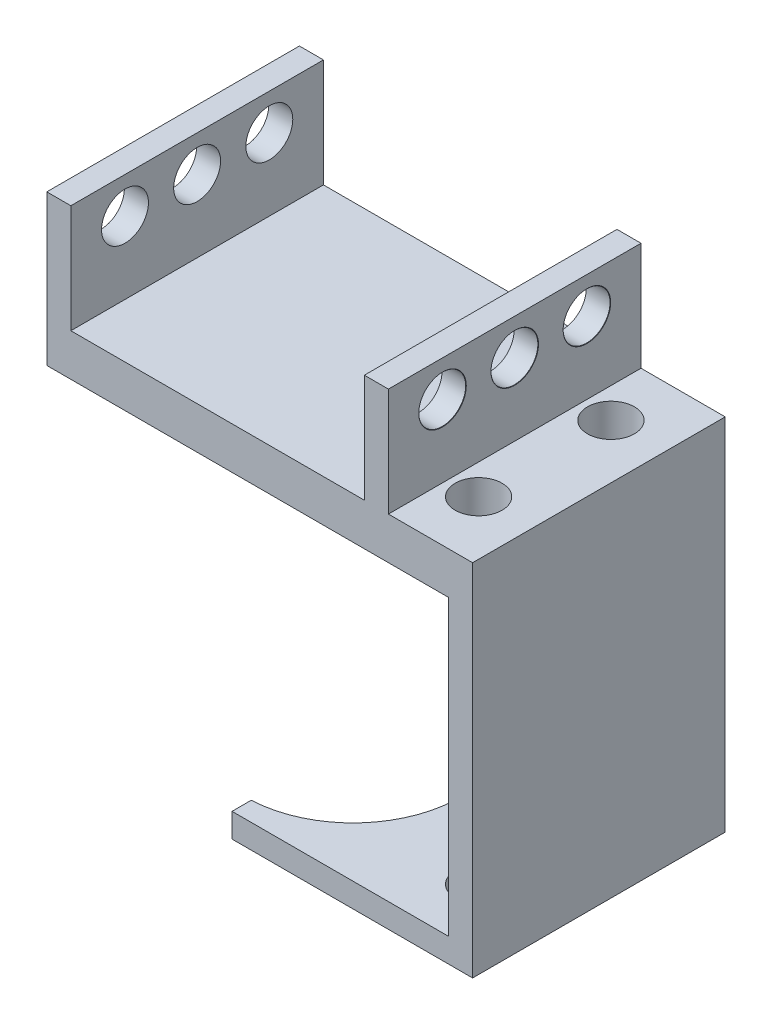
from build123d import *

# Parameters (mm, degrees)
BOSS_EXTRUDE1_DEPTH              = 21
M3_5_CLEARANCE_HOLE1_D           = 3.9
M3_5_CLEARANCE_HOLE1_CSINK_D     = 3.95
M3_5_CLEARANCE_HOLE1_CSINK_ANGLE = 90
SKETCH4_R                        = 9
SKETCH4_R_2                      = 2
CUT_EXTRUDE1_DEPTH               = 3
SKETCH5_R                        = 8.9
CUT_EXTRUDE2_DEPTH               = 3
M3_5_CLEARANCE_HOLE2_D           = 3.9
M3_5_CLEARANCE_HOLE2_CSINK_D     = 3.95
M3_5_CLEARANCE_HOLE2_CSINK_ANGLE = 90


with BuildPart() as part:
    # Sketch1 → Boss-Extrude1 (new body)
    with BuildSketch(Plane.XY):
        Polygon((14.42095576, -30), (21.42095576, -30), (21.42095576, -59.9), (1.42095576, -59.9), (1.42095576, -57.9), (19.42095576, -57.9), (19.42095576, -33.5), (14.42095576, -33.5), (-13.97904424, -33.5), (-13.97904424, -21), (-11.97904424, -21), (-11.97904424, -30), (12.42095576, -30), (12.42095576, -21), (14.42095576, -21), align=None)
    extrude(amount=-BOSS_EXTRUDE1_DEPTH)

    # M3.5 Clearance Hole1 (through all)
    with Locations(Plane(origin=(14.42095576, 0, 0), x_dir=(0, 0, -1), z_dir=(1, 0, 0))):
        with Locations((4.5, -24), (10.5, -24), (16.5, -24)):
            CounterSinkHole(M3_5_CLEARANCE_HOLE1_D / 2, M3_5_CLEARANCE_HOLE1_CSINK_D / 2, counter_sink_angle=M3_5_CLEARANCE_HOLE1_CSINK_ANGLE)

    # Sketch4 → Cut-Extrude1 (cut)
    with BuildSketch(Plane.XZ.offset(33.5)):
        with Locations((1.42095576, -10.5)):
            Circle(SKETCH4_R)
        with Locations((1.42095576, -4.5)):
            Circle(SKETCH4_R_2, mode=Mode.SUBTRACT)
        with Locations((1.42095576, -16.5)):
            Circle(SKETCH4_R_2, mode=Mode.SUBTRACT)
        with Locations((-4.57904424, -10.5)):
            Circle(SKETCH4_R_2, mode=Mode.SUBTRACT)
        with Locations((7.42095576, -10.5)):
            Circle(SKETCH4_R_2, mode=Mode.SUBTRACT)
    extrude(amount=-CUT_EXTRUDE1_DEPTH, mode=Mode.SUBTRACT)

    # Sketch5 → Cut-Extrude2 (cut)
    with BuildSketch(Plane.XZ.offset(59.9)):
        with Locations((0.99475454, -10.484843567)):
            Circle(SKETCH5_R)
    extrude(amount=-CUT_EXTRUDE2_DEPTH, mode=Mode.SUBTRACT)

    # M3.5 Clearance Hole2 (through all)
    with Locations(Plane(origin=(0, -59.9, 0), x_dir=(-1, 0, 0), z_dir=(0, -1, 0))):
        with Locations((-16.92095576, 16), (-16.92095576, 5)):
            CounterSinkHole(M3_5_CLEARANCE_HOLE2_D / 2, M3_5_CLEARANCE_HOLE2_CSINK_D / 2, counter_sink_angle=M3_5_CLEARANCE_HOLE2_CSINK_ANGLE)


solid = part.part
